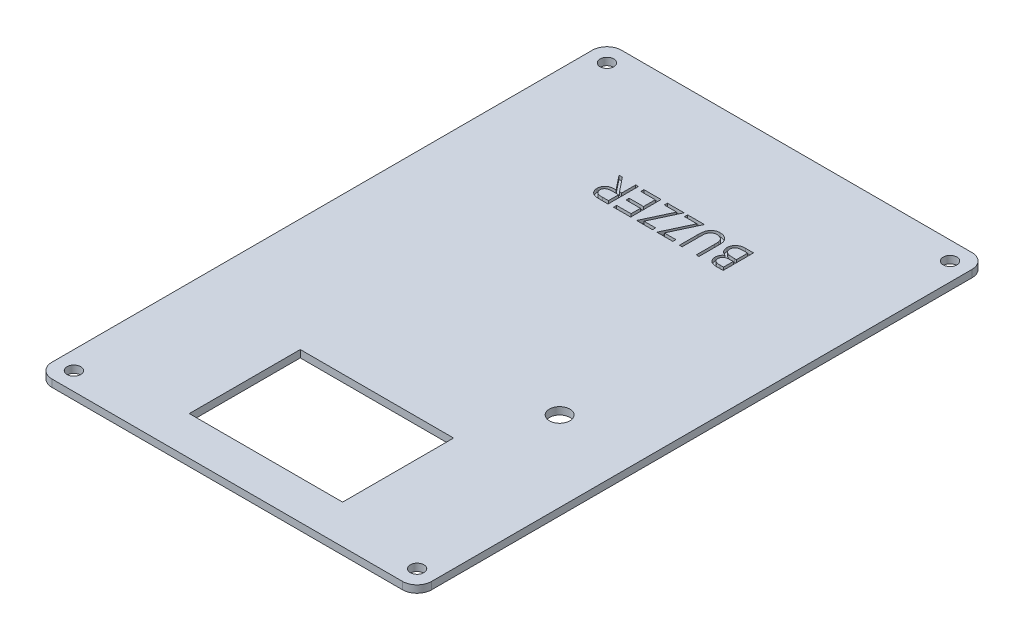
from build123d import *

# Parameters (mm, degrees)
SKETCH1_W               = 66.04
SKETCH1_H               = 99.06
BOSS_EXTRUDE1_DEPTH     = 1.27
FILLET1_R               = 2.54
CUT_EXTRUDE6_DEPTH      = 95.691488846
CUT_EXTRUDE6_DEPTH_BACK = 95.691488846
SKETCH3_W               = 26.67
SKETCH3_H               = 19.304
CUT_EXTRUDE7_DEPTH      = 0.635
SKETCH5_R               = 1.778
CUT_EXTRUDE8_DEPTH      = 95.691488975
SKETCH6_R               = 1.190625
CUT_EXTRUDE9_DEPTH      = 95.691488975


with BuildPart() as part:
    # Sketch1 → Boss-Extrude1 (new body)
    with BuildSketch(Plane(origin=(0, 0, 0), x_dir=(1, 0, 0), z_dir=(0, 1, 0))):
        with Locations((-1.400848485, 38.674707071)):
            Rectangle(SKETCH1_W, SKETCH1_H)
    extrude(amount=BOSS_EXTRUDE1_DEPTH)

    # Fillet1
    fillet1_edges = [part.edges().sort_by_distance(p)[0] for p in [
        (-34.420848485, 0.635, -88.204707071),
        (31.619151515, 0.635, -88.204707071),
        (31.619151515, 0.635, 10.855292929),
        (-34.420848485, 0.635, 10.855292929),
    ]]
    fillet(fillet1_edges, radius=FILLET1_R)

    # Sketch3 → Cut-Extrude6 (cut, two sides: drawn at the far end of the back side and taken through both)
    with BuildSketch(Plane(origin=(0, 1.27, 0), x_dir=(1, 0, 0), z_dir=(0, 1, 0)).offset(-CUT_EXTRUDE6_DEPTH_BACK)):
        with Locations((-1.400848485, 5.527707071)):
            Rectangle(SKETCH3_W, SKETCH3_H)
    extrude(amount=CUT_EXTRUDE6_DEPTH + CUT_EXTRUDE6_DEPTH_BACK, mode=Mode.SUBTRACT)

    # Sketch4 → Cut-Extrude7 (cut)
    # profile 1 of 6: a face of its own
    with BuildSketch(Plane(origin=(0, 1.27, 0), x_dir=(1, 0, 0), z_dir=(0, 1, 0))):
        with BuildLine():
            Line((10.132271173, 63.863040404), (9.099802557, 63.863040404))
            add(Edge.make_bspline(
                [(9.099802557, 63.863040404), (9.049261084, 63.863301939), (8.951299132, 63.863808858), (8.808859142, 63.8718533), (8.67539782, 63.882547624), (8.55115101, 63.900486778), (8.435310257, 63.919087314), (8.329051587, 63.946388448), (8.231484951, 63.976543545), (8.114327392, 64.022941254), (7.981396089, 64.094997482), (7.83851981, 64.201863715), (7.714323031, 64.329987698), (7.608718955, 64.475995084), (7.523969437, 64.636619753), (7.463432567, 64.808405815), (7.424541376, 64.988463175), (7.420591941, 65.111909143), (7.41859596, 65.174296748)],
                knots=[0, 0, 0, 0, 1.00128172, 1.940733171, 2.826250472, 3.653024905, 4.427672124, 5.149348099, 5.824709082, 6.450061444, 7.643590664, 8.808605388, 9.972104426, 11.165284501, 12.367876273, 13.557044126, 14.765369432, 16, 16, 16, 16], degree=3))
            add(Edge.make_bspline(
                [(7.41859596, 65.174296748), (7.420226305, 65.232743194), (7.423430088, 65.347595972), (7.454728455, 65.5150183), (7.50197258, 65.674891615), (7.570148723, 65.825675225), (7.657079033, 65.966044198), (7.762842819, 66.093604195), (7.888249682, 66.205850798), (7.982405847, 66.268317629), (8.030232912, 66.300047949)],
                knots=[0, 0, 0, 0, 1.044356178, 2.052258378, 3.035953355, 4.020338374, 5.002448483, 5.980768927, 6.974322109, 8, 8, 8, 8], degree=3))
            add(Edge.make_bspline(
                [(8.030232912, 66.300047949), (7.970114666, 66.323116826), (7.855093569, 66.367253302), (7.696604854, 66.445588304), (7.560010005, 66.530136535), (7.443548686, 66.621517711), (7.34596233, 66.722715685), (7.259028485, 66.83106534), (7.185250404, 66.950340128), (7.122301239, 67.077955419), (7.072435499, 67.213235413), (7.037821741, 67.355168052), (7.015869585, 67.502145753), (7.012998941, 67.602039464), (7.011544678, 67.652645439)],
                knots=[0, 0, 0, 0, 1.272200328, 2.434034374, 3.488177493, 4.442517805, 5.351202203, 6.260825393, 7.183200622, 8.11705787, 9.069326169, 10.026320267, 11.000137371, 12, 12, 12, 12], degree=3))
            add(Edge.make_bspline(
                [(7.011544678, 67.652645439), (7.013021717, 67.704302409), (7.015927835, 67.805938947), (7.037364577, 67.955248532), (7.073671501, 68.097929953), (7.123644547, 68.234932956), (7.188786927, 68.365455155), (7.267485693, 68.490522311), (7.36194081, 68.608280909), (7.468306562, 68.720439771), (7.586980139, 68.823004205), (7.717749137, 68.911144707), (7.857262081, 68.987275282), (8.007429435, 69.048479994), (8.167185659, 69.096392089), (8.336568178, 69.129518432), (8.515480811, 69.151928612), (8.638264002, 69.153765203), (8.70123151, 69.154707071)],
                knots=[0, 0, 0, 0, 0.978522333, 1.925270105, 2.85076145, 3.763600118, 4.682725947, 5.609499657, 6.557784645, 7.537954401, 8.534920712, 9.522742111, 10.520247711, 11.5409147, 12.58930695, 13.675078472, 14.807699069, 16, 16, 16, 16], degree=3))
            Line((8.70123151, 69.154707071), (10.132271173, 69.154707071))
            Line((10.132271173, 69.154707071), (10.132271173, 63.863040404))
        make_face()
        with BuildLine():
            Line((9.657378011, 64.405775447), (9.657378011, 66.101822455))
            Line((9.657378011, 66.101822455), (9.338309167, 66.101822455))
            add(Edge.make_bspline(
                [(9.338309167, 66.101822455), (9.291668307, 66.101222842), (9.201548659, 66.100064265), (9.070694375, 66.096640891), (8.949534376, 66.087475067), (8.837651194, 66.077780678), (8.735794632, 66.062853367), (8.643623982, 66.044586337), (8.560310352, 66.025436779), (8.464277966, 65.99277589), (8.355360774, 65.945011789), (8.240064905, 65.869070632), (8.136293439, 65.781147189), (8.05068797, 65.676856247), (7.97941831, 65.564231462), (7.931435214, 65.442432986), (7.897979616, 65.315658028), (7.895001286, 65.228227461), (7.893489122, 65.183837012)],
                knots=[0, 0, 0, 0, 1.156584208, 2.234756387, 3.244705828, 4.168772894, 5.018724976, 5.795346628, 6.498686023, 7.135894168, 8.308330183, 9.43588092, 10.547699294, 11.667188675, 12.76860303, 13.837480448, 14.902040606, 16, 16, 16, 16], degree=3))
            add(Edge.make_bspline(
                [(7.893489122, 65.183837012), (7.894226629, 65.154449566), (7.895673329, 65.096802881), (7.909311947, 65.012814972), (7.928133076, 64.932891676), (7.959173807, 64.85918758), (7.995949049, 64.789114634), (8.043086126, 64.724886309), (8.097439512, 64.664762651), (8.160808749, 64.610355219), (8.232934794, 64.561146838), (8.316102432, 64.520183209), (8.408050536, 64.483779332), (8.510696512, 64.456184341), (8.621995746, 64.432227495), (8.743646268, 64.417120441), (8.87491493, 64.407415431), (8.965865981, 64.406334301), (9.012880148, 64.405775447)],
                knots=[0, 0, 0, 0, 0.911412742, 1.787835618, 2.63643285, 3.453173233, 4.262886967, 5.08783453, 5.918594724, 6.773969545, 7.67442701, 8.62112486, 9.645634318, 10.739428598, 11.916091468, 13.177237585, 14.540865421, 16, 16, 16, 16], degree=3))
            Line((9.012880148, 64.405775447), (9.657378011, 64.405775447))
        make_face(mode=Mode.SUBTRACT)
        with BuildLine():
            Line((9.657378011, 66.644557498), (9.657378011, 68.611972028))
            Line((9.657378011, 68.611972028), (8.981079266, 68.611972028))
            add(Edge.make_bspline(
                [(8.981079266, 68.611972028), (8.932674539, 68.611336049), (8.839380809, 68.610110283), (8.704578215, 68.60720171), (8.58030054, 68.596410914), (8.465513043, 68.586065365), (8.360746835, 68.569163762), (8.264982885, 68.552797178), (8.180408487, 68.528712941), (8.081451556, 68.495572604), (7.970769223, 68.442609954), (7.849898894, 68.36472384), (7.743437276, 68.269852814), (7.653112054, 68.160614213), (7.578010591, 68.043064337), (7.526055211, 67.916971826), (7.492391082, 67.786548376), (7.488426249, 67.697369605), (7.48643784, 67.652645439)],
                knots=[0, 0, 0, 0, 1.16016216, 2.236059617, 3.229676189, 4.14889023, 4.996733752, 5.772278665, 6.474820656, 7.101410824, 8.271817372, 9.403828207, 10.537358096, 11.673541442, 12.791884111, 13.865947414, 14.929748409, 16, 16, 16, 16], degree=3))
            add(Edge.make_bspline(
                [(7.48643784, 67.652645439), (7.486843735, 67.624681075), (7.487648979, 67.569203416), (7.500306603, 67.487748973), (7.517872147, 67.408455386), (7.543758826, 67.332399726), (7.575074668, 67.258272326), (7.616388242, 67.188485156), (7.662989648, 67.120067488), (7.735168179, 67.032553714), (7.841584097, 66.932940206), (7.99285808, 66.836631052), (8.163900151, 66.757702698), (8.288247313, 66.72433574), (8.352481844, 66.707099231)],
                knots=[0, 0, 0, 0, 0.723354195, 1.435040621, 2.129761981, 2.824182007, 3.512608497, 4.209435533, 4.920062464, 5.654614313, 7.143585817, 8.671381114, 10.280521501, 12, 12, 12, 12], degree=3))
            add(Edge.make_bspline(
                [(8.352481844, 66.707099231), (8.378228191, 66.701875122), (8.434051582, 66.690548177), (8.525080172, 66.678599234), (8.62935073, 66.667880644), (8.746417585, 66.660160265), (8.876746327, 66.651872572), (9.020295087, 66.648764182), (9.177165348, 66.644970228), (9.286011091, 66.644698594), (9.342549285, 66.644557498)],
                knots=[0, 0, 0, 0, 0.634452549, 1.375623993, 2.216454381, 3.166361212, 4.209414599, 5.370755378, 6.634280627, 8, 8, 8, 8], degree=3))
            Line((9.342549285, 66.644557498), (9.657378011, 66.644557498))
        make_face(mode=Mode.SUBTRACT)
    # profile 2 of 6: a face of its own
    with BuildSketch(Plane(origin=(0, 1.27, 0), x_dir=(1, 0, 0), z_dir=(0, 1, 0))):
        with BuildLine():
            Line((5.926074592, 63.863040404), (5.45118143, 63.863040404))
            Line((5.45118143, 63.863040404), (5.45118143, 67.033588281))
            add(Edge.make_bspline(
                [(5.45118143, 67.033588281), (5.451252102, 67.078462726), (5.451386215, 67.16361972), (5.450490391, 67.284826556), (5.447981584, 67.392583726), (5.44639989, 67.487306597), (5.442881183, 67.568560512), (5.440011517, 67.636785684), (5.436321628, 67.691659062), (5.431887034, 67.723682605), (5.429980842, 67.737447789)],
                knots=[0, 0, 0, 0, 1.528628734, 2.90083645, 4.128790002, 5.200304208, 6.127813768, 6.898992206, 7.526736466, 8, 8, 8, 8], degree=3))
            add(Edge.make_bspline(
                [(5.429980842, 67.737447789), (5.422249874, 67.787494129), (5.407325589, 67.88410634), (5.367531213, 68.021513335), (5.314912575, 68.1460081), (5.24785472, 68.258981609), (5.165147476, 68.361228191), (5.063103152, 68.453730874), (4.941932365, 68.53675615), (4.80439031, 68.609584074), (4.657748497, 68.669986049), (4.507373116, 68.715204463), (4.356136732, 68.74287314), (4.25487265, 68.746068858), (4.204586878, 68.747655789)],
                knots=[0, 0, 0, 0, 1.042923073, 2.013316119, 2.939979093, 3.821796737, 4.712412725, 5.640305549, 6.650442997, 7.732186751, 8.842579391, 9.91407549, 10.964170509, 12, 12, 12, 12], degree=3))
            add(Edge.make_bspline(
                [(4.204586878, 68.747655789), (4.161412469, 68.746041319), (4.075313013, 68.742821704), (3.94745384, 68.72263631), (3.822527217, 68.686981982), (3.701541501, 68.638387965), (3.586362563, 68.578725573), (3.480087059, 68.50675651), (3.383834176, 68.424146934), (3.297032095, 68.331283855), (3.221478832, 68.227598213), (3.156438921, 68.113630216), (3.10329787, 67.988470866), (3.076601704, 67.900265628), (3.062935236, 67.85511105)],
                knots=[0, 0, 0, 0, 0.994543961, 1.983343699, 2.972712664, 3.980751554, 4.981834161, 5.954730495, 6.930176574, 7.89761099, 8.875938748, 9.87834379, 10.913868493, 12, 12, 12, 12], degree=3))
            add(Edge.make_bspline(
                [(3.062935236, 67.85511105), (3.058399332, 67.836441182), (3.048291511, 67.794837191), (3.038846574, 67.724501431), (3.029009327, 67.64151394), (3.022183727, 67.545278461), (3.015529501, 67.436117467), (3.011548545, 67.313462292), (3.009708508, 67.177758315), (3.009160169, 67.083056892), (3.008873737, 67.033588281)],
                knots=[0, 0, 0, 0, 0.558680831, 1.244966039, 2.062412453, 2.990489873, 4.051219941, 5.244515665, 6.560634259, 8, 8, 8, 8], degree=3))
            Line((3.008873737, 67.033588281), (3.008873737, 63.863040404))
            Line((3.008873737, 63.863040404), (2.533980575, 63.863040404))
            Line((2.533980575, 63.863040404), (2.533980575, 67.059028986))
            add(Edge.make_bspline(
                [(2.533980575, 67.059028986), (2.534360587, 67.116630716), (2.535102204, 67.229043995), (2.541662525, 67.393759603), (2.551823841, 67.550049391), (2.567173222, 67.697716754), (2.584157182, 67.836927876), (2.608252018, 67.967172865), (2.633876204, 68.089556657), (2.666034204, 68.204304989), (2.704287941, 68.313149262), (2.749842657, 68.41814533), (2.805325708, 68.518348518), (2.868128967, 68.615595735), (2.939538274, 68.708990778), (3.018944739, 68.799258379), (3.107619296, 68.885211844), (3.203327087, 68.967262104), (3.305291065, 69.044108869), (3.414655173, 69.109537586), (3.529461769, 69.164910902), (3.648493258, 69.212073761), (3.77376145, 69.246561701), (3.903706002, 69.272454695), (4.03924017, 69.287102423), (4.13141179, 69.289285403), (4.178086144, 69.290390831)],
                knots=[0, 0, 0, 0, 1.316485072, 2.56920066, 3.767172097, 4.895413872, 5.962239305, 6.971350037, 7.921780903, 8.819233545, 9.69278517, 10.557066787, 11.431700348, 12.307563454, 13.200791052, 14.11626757, 15.05287325, 16.020813301, 16.99640464, 17.967304965, 18.928075993, 19.907403966, 20.889159767, 21.893313923, 22.933205135, 24, 24, 24, 24], degree=3))
            add(Edge.make_bspline(
                [(4.178086144, 69.290390831), (4.228990992, 69.289205163), (4.328866123, 69.286878887), (4.476026744, 69.273528083), (4.617128112, 69.248445092), (4.753547339, 69.216300014), (4.883966462, 69.172689872), (5.008347049, 69.119104638), (5.128117248, 69.057928953), (5.240578665, 68.985640235), (5.346653857, 68.906814254), (5.443051952, 68.820232558), (5.532220025, 68.729192619), (5.610227747, 68.630266328), (5.680025628, 68.525478795), (5.740075637, 68.414337157), (5.791656495, 68.296990403), (5.818275285, 68.215417658), (5.831731977, 68.174179894)],
                knots=[0, 0, 0, 0, 1.138939089, 2.234594419, 3.301501784, 4.342532435, 5.367382236, 6.373123747, 7.370098489, 8.372230273, 9.360297234, 10.323289009, 11.268038109, 12.20748145, 13.137029304, 14.081414587, 15.030090602, 16, 16, 16, 16], degree=3))
            add(Edge.make_bspline(
                [(5.831731977, 68.174179894), (5.839559347, 68.146009216), (5.856537087, 68.084906388), (5.874718192, 67.983780387), (5.890002161, 67.867341167), (5.90437366, 67.735580755), (5.91285387, 67.588397029), (5.920288569, 67.425853787), (5.926126969, 67.247754487), (5.926092539, 67.123695875), (5.926074592, 67.059028986)],
                knots=[0, 0, 0, 0, 0.625038921, 1.35572334, 2.194682327, 3.136881307, 4.189498639, 5.346923369, 6.617055217, 8, 8, 8, 8], degree=3))
            Line((5.926074592, 67.059028986), (5.926074592, 63.863040404))
        make_face()
    # profile 3 of 6: a face of its own
    with BuildSketch(Plane(origin=(0, 1.27, 0), x_dir=(1, 0, 0), z_dir=(0, 1, 0))):
        Polygon((1.380668609, 64.405775447), (1.380668609, 63.863040404), (-1.400848485, 63.863040404), (0.818853038, 68.611972028), (-1.333006605, 68.611972028), (-1.333006605, 69.154707071), (1.58419425, 69.154707071), (-0.635507272, 64.405775447), align=None)
    # profile 4 of 6: a face of its own
    with BuildSketch(Plane(origin=(0, 1.27, 0), x_dir=(1, 0, 0), z_dir=(0, 1, 0))):
        Polygon((-2.147109169, 64.405775447), (-2.147109169, 63.863040404), (-4.928626263, 63.863040404), (-2.70892474, 68.611972028), (-4.860784382, 68.611972028), (-4.860784382, 69.154707071), (-1.943583528, 69.154707071), (-4.16328505, 64.405775447), align=None)
    # profile 5 of 6: a face of its own
    with BuildSketch(Plane(origin=(0, 1.27, 0), x_dir=(1, 0, 0), z_dir=(0, 1, 0))):
        Polygon((-5.946254468, 63.863040404), (-8.931297203, 63.863040404), (-8.931297203, 64.405775447), (-6.42114763, 64.405775447), (-6.42114763, 66.033980575), (-8.931297203, 66.033980575), (-8.931297203, 66.576715618), (-6.42114763, 66.576715618), (-6.42114763, 68.611972028), (-8.931297203, 68.611972028), (-8.931297203, 69.154707071), (-5.946254468, 69.154707071), align=None)
    # profile 6 of 6: a face of its own
    with BuildSketch(Plane(origin=(0, 1.27, 0), x_dir=(1, 0, 0), z_dir=(0, 1, 0))):
        with BuildLine():
            Line((-9.881083528, 63.863040404), (-10.940052879, 63.863040404))
            add(Edge.make_bspline(
                [(-10.940052879, 63.863040404), (-11.010721013, 63.863275635), (-11.14641166, 63.863727305), (-11.3408022, 63.86624578), (-11.517433644, 63.873464151), (-11.676213639, 63.879675938), (-11.817139272, 63.89100304), (-11.940642676, 63.901829256), (-12.046155029, 63.916001339), (-12.110026732, 63.929163109), (-12.138946108, 63.935122402)],
                knots=[0, 0, 0, 0, 1.410062039, 2.707475311, 3.878576406, 4.937260626, 5.877586885, 6.699081471, 7.410979367, 8, 8, 8, 8], degree=3))
            add(Edge.make_bspline(
                [(-12.138946108, 63.935122402), (-12.177661537, 63.944686809), (-12.254266489, 63.96361159), (-12.364550584, 64.003631352), (-12.469684512, 64.049868617), (-12.569283268, 64.104590798), (-12.663320754, 64.166873841), (-12.751787496, 64.236968126), (-12.833497328, 64.315474219), (-12.911357361, 64.399140089), (-12.979344042, 64.491608443), (-13.040550091, 64.588186759), (-13.091930472, 64.69073441), (-13.132361098, 64.798734168), (-13.166255276, 64.91112661), (-13.189035327, 65.029022328), (-13.203223142, 65.152037747), (-13.204624899, 65.235738739), (-13.205335664, 65.278179627)],
                knots=[0, 0, 0, 0, 1.027276577, 2.032638556, 3.019345632, 3.985365262, 4.957888996, 5.923693931, 6.890056973, 7.876427719, 8.865527834, 9.843495157, 10.821038291, 11.815616373, 12.812734995, 13.843357168, 14.906466538, 16, 16, 16, 16], degree=3))
            add(Edge.make_bspline(
                [(-13.205335664, 65.278179627), (-13.203114737, 65.348687545), (-13.198781132, 65.486266754), (-13.158374515, 65.685929097), (-13.092191531, 65.872183752), (-13.000977616, 66.04477152), (-12.884874028, 66.200419122), (-12.745343918, 66.336667098), (-12.583099855, 66.451734722), (-12.431352159, 66.530681254), (-12.297242603, 66.581478836), (-12.186511197, 66.617399626), (-12.065630232, 66.644684936), (-11.93633393, 66.66948347), (-11.797623592, 66.688406744), (-11.649778547, 66.701845865), (-11.492429026, 66.710487322), (-11.3845701, 66.711749876), (-11.329083661, 66.712399378)],
                knots=[0, 0, 0, 0, 1.260402266, 2.459371274, 3.627181936, 4.786749125, 5.93865593, 7.087644312, 8.261344208, 9.485713728, 10.136162886, 10.825977872, 11.566646758, 12.35154167, 13.181268117, 14.0701832, 15.007234106, 16, 16, 16, 16], degree=3))
            Line((-11.329083661, 66.712399378), (-13.273177545, 69.154707071))
            Line((-13.273177545, 69.154707071), (-12.685921268, 69.154707071))
            Line((-12.685921268, 69.154707071), (-10.741827384, 66.712399378))
            Line((-10.741827384, 66.712399378), (-10.35597669, 66.712399378))
            Line((-10.35597669, 66.712399378), (-10.35597669, 69.154707071))
            Line((-10.35597669, 69.154707071), (-9.881083528, 69.154707071))
            Line((-9.881083528, 69.154707071), (-9.881083528, 63.863040404))
        make_face()
        with BuildLine():
            Line((-10.35597669, 64.405775447), (-10.35597669, 66.169664336))
            Line((-10.35597669, 66.169664336), (-11.324843544, 66.177084541))
            add(Edge.make_bspline(
                [(-11.324843544, 66.177084541), (-11.370079799, 66.177104565), (-11.457760545, 66.177143378), (-11.584610282, 66.171105013), (-11.702720714, 66.164236478), (-11.811638593, 66.153727963), (-11.911417475, 66.140193039), (-12.001991454, 66.123236265), (-12.083560686, 66.10356447), (-12.178391346, 66.0728061), (-12.285502734, 66.026176236), (-12.399508396, 65.953872579), (-12.499203084, 65.866431962), (-12.582088209, 65.76518042), (-12.648661636, 65.653377793), (-12.694902811, 65.533554338), (-12.725375476, 65.407597994), (-12.72873402, 65.321113842), (-12.730442502, 65.277119597)],
                knots=[0, 0, 0, 0, 1.146399208, 2.222048177, 3.218135709, 4.144938032, 4.994811973, 5.769438708, 6.479732432, 7.119818093, 8.294689872, 9.430121864, 10.527913442, 11.641375077, 12.733452768, 13.811150417, 14.886538365, 16, 16, 16, 16], degree=3))
            add(Edge.make_bspline(
                [(-12.730442502, 65.277119597), (-12.728647513, 65.234556336), (-12.7250905, 65.150211484), (-12.695388001, 65.027010699), (-12.646888525, 64.909862922), (-12.580505189, 64.800380183), (-12.497884008, 64.70173469), (-12.401648941, 64.617589943), (-12.294064612, 64.547684885), (-12.194326939, 64.501561358), (-12.104527907, 64.474422203), (-12.026919505, 64.45472192), (-11.938464098, 64.440924735), (-11.840202793, 64.42823501), (-11.731703936, 64.417488757), (-11.612901408, 64.410355924), (-11.483880154, 64.406092618), (-11.394455651, 64.405883631), (-11.34816419, 64.405775447)],
                knots=[0, 0, 0, 0, 1.100596872, 2.180981401, 3.259506136, 4.371595435, 5.481727359, 6.576991111, 7.667816242, 8.793363246, 9.406619729, 10.09427138, 10.864108636, 11.721733836, 12.6590937, 13.685439239, 14.801845161, 16, 16, 16, 16], degree=3))
            Line((-11.34816419, 64.405775447), (-10.35597669, 64.405775447))
        make_face(mode=Mode.SUBTRACT)
    extrude(amount=-CUT_EXTRUDE7_DEPTH, mode=Mode.SUBTRACT)

    # Sketch5 → Cut-Extrude8 (cut, through all)
    with BuildSketch(Plane(origin=(0, 1.27, 0), x_dir=(-1, 0, 0), z_dir=(0, 1, 0))):
        with Locations(Location((-17.679877322, -27.879707071, 0), (0, 0, 90))):
            Circle(SKETCH5_R)
    extrude(amount=-CUT_EXTRUDE8_DEPTH, mode=Mode.SUBTRACT)

    # Sketch6 → Cut-Extrude9 (cut, through all)
    with BuildSketch(Plane(origin=(0, 1.27, 0), x_dir=(1, 0, 0), z_dir=(0, 1, 0))):
        with Locations(Location((28.444151515, -7.680292929, 0), (0, 0, 270))):
            Circle(SKETCH6_R)
        with Locations(Location((-31.245848485, -7.680292929, 0), (0, 0, 270))):
            Circle(SKETCH6_R)
        with Locations(Location((-31.245848485, 85.029707071, 0), (0, 0, 270))):
            Circle(SKETCH6_R)
        with Locations(Location((28.444151515, 85.029707071, 0), (0, 0, 270))):
            Circle(SKETCH6_R)
    extrude(amount=-CUT_EXTRUDE9_DEPTH, mode=Mode.SUBTRACT)


solid = part.part
